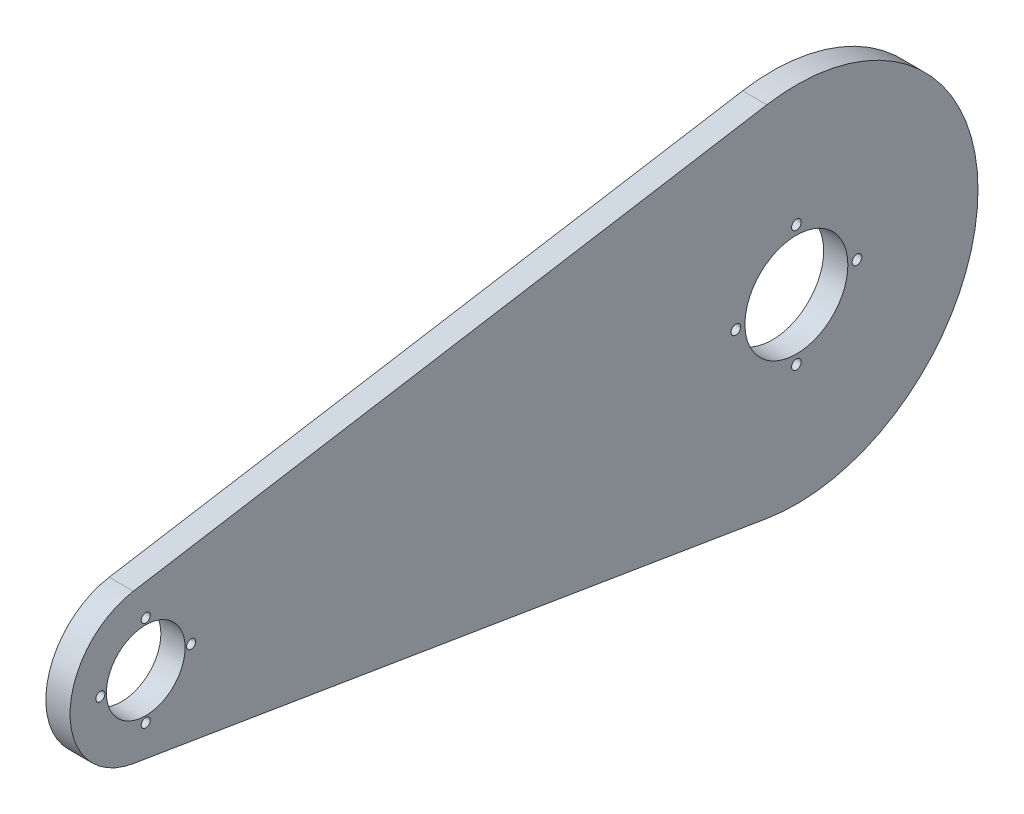
from build123d import *

# Parameters (mm, degrees)
SKETCH1_R           = 17
SKETCH1_R_2         = 13
BOSS_EXTRUDE1_DEPTH = 4
SKETCH2_R           = 1.6
SKETCH2_R_2         = 1.5
CUT_EXTRUDE1_DEPTH  = 248.51565607


with BuildPart() as part:
    # Sketch1 → Boss-Extrude1 (new, symmetric)
    with BuildSketch(Plane(origin=(0, 0, 0), x_dir=(0, 0, -1), z_dir=(1, 0, 0))):
        with BuildLine():
            Line((-219.069767442, 24.666515623), (-9.76744186, 59.199637495))
            ThreePointArc((-9.76744186, 59.199637495), (60, 0), (-9.76744186, -59.199637495))
            Line((-9.76744186, -59.199637495), (-219.069767442, -24.666515623))
            ThreePointArc((-219.069767442, -24.666515623), (-240, 0), (-219.069767442, 24.666515623))
        make_face()
        Circle(SKETCH1_R, mode=Mode.SUBTRACT)
        with Locations((-215, 0)):
            Circle(SKETCH1_R_2, mode=Mode.SUBTRACT)
    extrude(amount=BOSS_EXTRUDE1_DEPTH, both=True)

    # Sketch2 → Cut-Extrude1 (cut, through all)
    with BuildSketch(Plane(origin=(4, 0, 0), x_dir=(0, 0, -1), z_dir=(1, 0, 0))):
        with Locations((0, 20)):
            Circle(SKETCH2_R)
        with Locations((20, 0)):
            Circle(SKETCH2_R)
        with Locations((0, -20)):
            Circle(SKETCH2_R)
        with Locations((-20, 0)):
            Circle(SKETCH2_R)
        with Locations((-215, 15)):
            Circle(SKETCH2_R_2)
        with Locations((-200, 0)):
            Circle(SKETCH2_R_2)
        with Locations((-215, -15)):
            Circle(SKETCH2_R_2)
        with Locations((-230, 0)):
            Circle(SKETCH2_R_2)
    extrude(amount=-CUT_EXTRUDE1_DEPTH, mode=Mode.SUBTRACT)


solid = part.part
